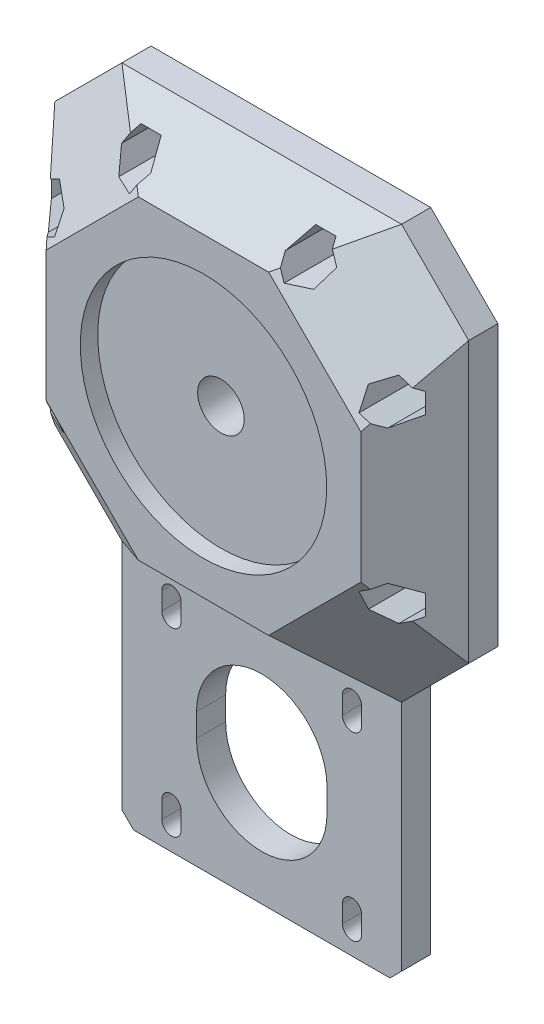
from build123d import *

# Parameters (mm, degrees)
EXTRUDE_1_DEPTH     = 5
SKETCH_5_R          = 21.15
CUT_EXTRUDE_1_DEPTH = 3
SKETCH_6_R          = 4
CUT_EXTRUDE_2_DEPTH = 37
SKETCH_7_R          = 1.8
CUT_EXTRUDE_3_DEPTH = 37
CUT_EXTRUDE_4_DEPTH = 12
CHAMFER_1_SIZE      = 2


with BuildPart() as part:
    # 草图1 → 凸台-拉伸1 (new body)
    with BuildSketch(Plane.XY):
        Polygon((24, 35.52), (35.52, 24), (35.52, -24), (24, -35.52), (24, -77.52), (-24, -77.52), (-24, -35.52), (-35.52, -24), (-35.52, 24), (-24, 35.52), align=None)
        with BuildLine():
            Line((11.2, -54.52), (11.2, -58.52))
            ThreePointArc((11.2, -58.52), (0, -69.72), (-11.2, -58.52))
            Line((-11.2, -58.52), (-11.2, -54.52))
            ThreePointArc((-11.2, -54.52), (0, -43.32), (11.2, -54.52))
        make_face(mode=Mode.SUBTRACT)
        with BuildLine():
            Line((-17.15, -42.52), (-17.15, -39.52))
            ThreePointArc((-17.15, -39.52), (-15.5, -37.87), (-13.85, -39.52))
            Line((-13.85, -39.52), (-13.85, -42.52))
            ThreePointArc((-13.85, -42.52), (-15.5, -44.17), (-17.15, -42.52))
        make_face(mode=Mode.SUBTRACT)
        with BuildLine():
            Line((17.15, -42.52), (17.15, -39.52))
            ThreePointArc((17.15, -39.52), (15.5, -37.87), (13.85, -39.52))
            Line((13.85, -39.52), (13.85, -42.52))
            ThreePointArc((13.85, -42.52), (15.5, -44.17), (17.15, -42.52))
        make_face(mode=Mode.SUBTRACT)
        with BuildLine():
            Line((17.15, -70.52), (17.15, -73.52))
            ThreePointArc((17.15, -73.52), (15.5, -75.17), (13.85, -73.52))
            Line((13.85, -73.52), (13.85, -70.52))
            ThreePointArc((13.85, -70.52), (15.5, -68.87), (17.15, -70.52))
        make_face(mode=Mode.SUBTRACT)
        with BuildLine():
            Line((-17.15, -70.52), (-17.15, -73.52))
            ThreePointArc((-17.15, -73.52), (-15.5, -75.17), (-13.85, -73.52))
            Line((-13.85, -73.52), (-13.85, -70.52))
            ThreePointArc((-13.85, -70.52), (-15.5, -68.87), (-17.15, -70.52))
        make_face(mode=Mode.SUBTRACT)
    extrude(amount=EXTRUDE_1_DEPTH)

    # 草图3 → 放样1 section 0
    with BuildSketch(Plane.XY.offset(15)):
        with BuildLine():
            Line((11.183766184, 27), (-11.183766184, 27))
            Line((-11.183766184, 27), (-27, 11.183766184))
            Line((-27, 11.183766184), (-27, -11.183766184))
            Line((-27, -11.183766184), (-11.183766184, -27))
            Line((-11.183766184, -27), (11.183766184, -27))
            Line((11.183766184, -27), (27, -11.183766184))
            Line((27, -11.183766184), (27, 11.183766184))
            Line((27, 11.183766184), (11.183766184, 27))
        make_face()
    # 草图4 → 放样1 section 1
    with BuildSketch(Plane.XY.offset(5)):
        with BuildLine():
            Line((-24, -35.52), (24, -35.52))
            Line((24, -35.52), (35.52, -24))
            Line((35.52, -24), (35.52, 24))
            Line((35.52, 24), (24, 35.52))
            Line((24, 35.52), (-24, 35.52))
            Line((-24, 35.52), (-35.52, 24))
            Line((-35.52, 24), (-35.52, -24))
            Line((-35.52, -24), (-24, -35.52))
        make_face()
    loft()

    # 草图5 → 切除-拉伸1 (cut)
    with BuildSketch(Plane.XY.offset(15)):
        Circle(SKETCH_5_R)
    extrude(amount=-CUT_EXTRUDE_1_DEPTH, mode=Mode.SUBTRACT)

    # 草图6 → 切除-拉伸2 (cut)
    with BuildSketch(Plane.XY.offset(12)):
        Circle(SKETCH_6_R)
    extrude(amount=-CUT_EXTRUDE_2_DEPTH, mode=Mode.SUBTRACT)

    # 草图7 → 切除-拉伸3 (cut)
    with BuildSketch(Plane(origin=(0, 0, 0), x_dir=(-1, 0, 0), z_dir=(0, 0, -1))):
        with Locations((29.12, 15)):
            Circle(SKETCH_7_R)
        with Locations(Location((29.12, -15, 0), (0, 0, 314.737833249))):
            Circle(SKETCH_7_R)
        with Locations((-29.12, -15)):
            Circle(SKETCH_7_R)
        with Locations(Location((-29.12, 15, 0), (0, 0, 292.492646576))):
            Circle(SKETCH_7_R)
        with Locations((-15, 29.12)):
            Circle(SKETCH_7_R)
        with Locations(Location((15, 29.12, 0), (0, 0, 44.737833249))):
            Circle(SKETCH_7_R)
    extrude(amount=-CUT_EXTRUDE_3_DEPTH, mode=Mode.SUBTRACT)

    # 草图8 → 切除-拉伸4 (cut)
    with BuildSketch(Plane.XY.offset(15)):
        Polygon((-29.12, -11.535898385), (-32.12, -13.267949192), (-32.12, -16.732050808), (-29.12, -18.464101615), (-26.12, -16.732050808), (-26.12, -13.267949192), align=None)
        Polygon((-26.12, 13.267949192), (-29.12, 11.535898385), (-32.12, 13.267949192), (-32.12, 16.732050808), (-29.12, 18.464101615), (-26.12, 16.732050808), align=None)
        Polygon((13.267949192, 26.12), (11.535898385, 29.12), (13.267949192, 32.12), (16.732050808, 32.12), (18.464101615, 29.12), (16.732050808, 26.12), align=None)
        Polygon((-11.535898385, 29.12), (-13.267949192, 32.12), (-16.732050808, 32.12), (-18.464101615, 29.12), (-16.732050808, 26.12), (-13.267949192, 26.12), align=None)
        Polygon((26.12, -13.267949192), (29.12, -11.535898385), (32.12, -13.267949192), (32.12, -16.732050808), (29.12, -18.464101615), (26.12, -16.732050808), align=None)
        Polygon((29.12, 11.535898385), (32.12, 13.267949192), (32.12, 16.732050808), (29.12, 18.464101615), (26.12, 16.732050808), (26.12, 13.267949192), align=None)
    extrude(amount=-CUT_EXTRUDE_4_DEPTH, mode=Mode.SUBTRACT)

    # 倒角1
    chamfer_1_edges = [part.edges().sort_by_distance(p)[0] for p in [
        (24, -77.52, 2.5),
        (-24, -77.52, 2.5),
    ]]
    chamfer(chamfer_1_edges, length=CHAMFER_1_SIZE)


solid = part.part
